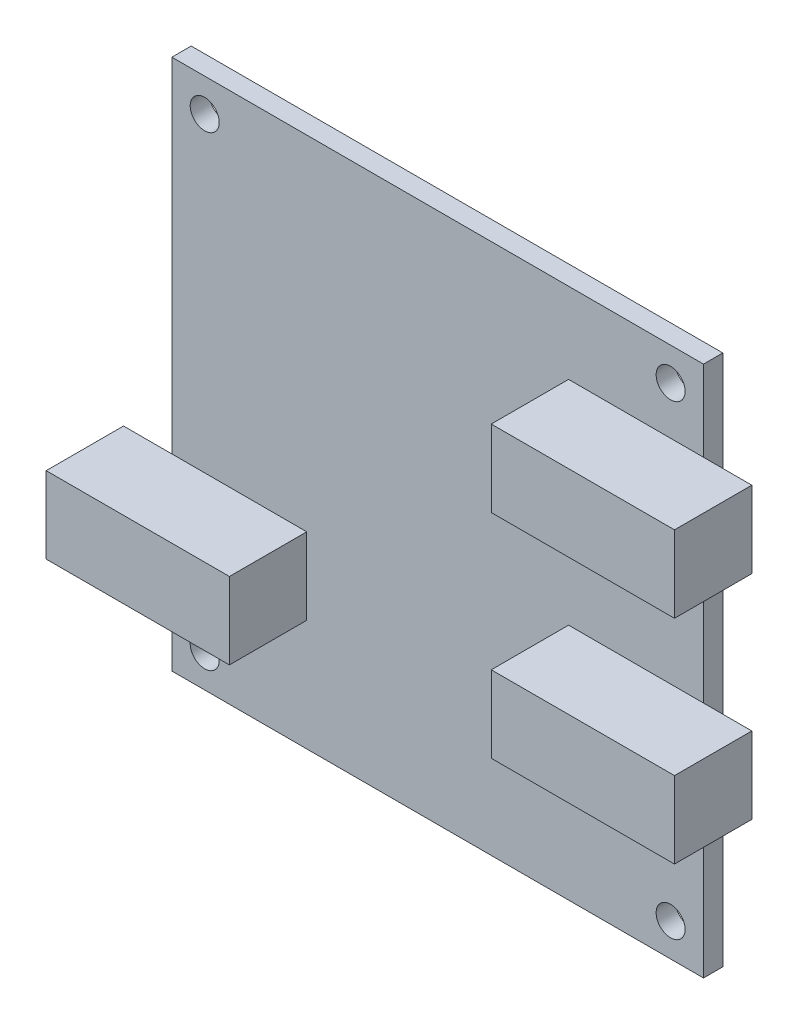
from build123d import *

# Parameters (mm, degrees)
SKIZZE1_W                         = 55
SKIZZE1_H                         = 55
AUFSATZ_LINEAR_AUSTRAGEN1_DEPTH   = 2
SKIZZE2_R                         = 1.5
SCHNITT_LINEAR_AUSTRAGEN1_DEPTH   = 2
SKIZZE3_W                         = 18.956359153
SKIZZE3_H                         = 7.92791832
AUFSATZ_LINEAR_AUSTRAGEN2_DEPTH   = 8
SKIZZE3_H_2                       = 7.927918321
AUFSATZ_LINEAR_AUSTRAGEN2_2_DEPTH = 8
AUFSATZ_LINEAR_AUSTRAGEN2_3_DEPTH = 8


with BuildPart() as part:
    # Skizze1 → Aufsatz-Linear austragen1 (new body)
    with BuildSketch(Plane(origin=(0, 0, 0), x_dir=(0, 1, 0), z_dir=(0, 0, 1))):
        Rectangle(SKIZZE1_W, SKIZZE1_H)
    extrude(amount=AUFSATZ_LINEAR_AUSTRAGEN1_DEPTH)

    # Skizze2 → Schnitt-Linear austragen1 (cut)
    with BuildSketch(Plane.XY.offset(2)):
        with Locations((24.1, 24.1)):
            Circle(SKIZZE2_R)
        with Locations((24.1, -24.1)):
            Circle(SKIZZE2_R)
        with Locations((-24.1, -24.1)):
            Circle(SKIZZE2_R)
        with Locations((-24.1, 24.1)):
            Circle(SKIZZE2_R)
    extrude(amount=-SCHNITT_LINEAR_AUSTRAGEN1_DEPTH, mode=Mode.SUBTRACT)


with BuildPart() as body_2:
    # Skizze3 → Aufsatz-Linear austragen2 (new body)
    with BuildSketch(Plane.XY.offset(2)):
        with Locations((-23.021820423, -12.009618842)):
            Rectangle(SKIZZE3_W, SKIZZE3_H)
    extrude(amount=AUFSATZ_LINEAR_AUSTRAGEN2_DEPTH)


with BuildPart() as body_3:
    # Skizze3 → Aufsatz-Linear austragen2 2 (new body)
    with BuildSketch(Plane.XY.offset(2)):
        with Locations((23.021820423, 15.188635595)):
            Rectangle(SKIZZE3_W, SKIZZE3_H_2)
    extrude(amount=AUFSATZ_LINEAR_AUSTRAGEN2_2_DEPTH)


with BuildPart() as body_4:
    # Skizze3 → Aufsatz-Linear austragen2 3 (new body)
    with BuildSketch(Plane.XY.offset(2)):
        with Locations((23.021820423, -6.82899895)):
            Rectangle(SKIZZE3_W, SKIZZE3_H_2)
    extrude(amount=AUFSATZ_LINEAR_AUSTRAGEN2_3_DEPTH)


solid = Compound([part.part, body_2.part, body_3.part, body_4.part])
